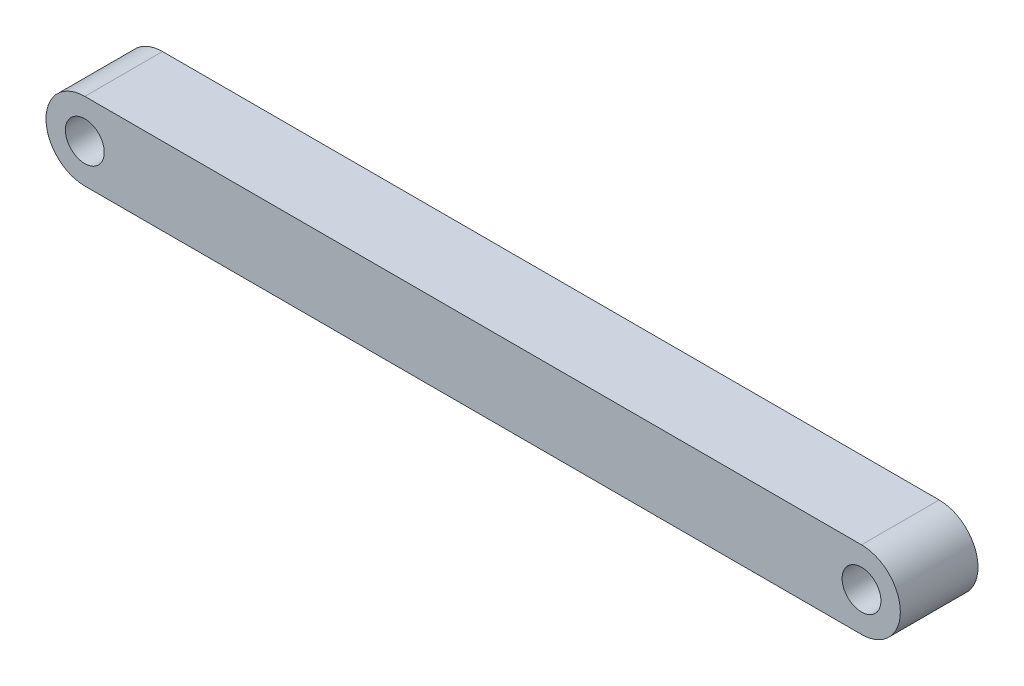
from build123d import *

# Parameters (mm, degrees)
SKETCH1_R           = 1.25
BOSS_EXTRUDE1_DEPTH = 5


with BuildPart() as part:
    # Sketch1 → Boss-Extrude1 (new body)
    with BuildSketch(Plane.XY):
        with BuildLine():
            Line((-25, 2.5), (25, 2.5))
            ThreePointArc((25, 2.5), (27.5, 0), (25, -2.5))
            Line((25, -2.5), (-25, -2.5))
            ThreePointArc((-25, -2.5), (-27.5, 0), (-25, 2.5))
        make_face()
        with Locations((-25, 0)):
            Circle(SKETCH1_R, mode=Mode.SUBTRACT)
        with Locations((25, 0)):
            Circle(SKETCH1_R, mode=Mode.SUBTRACT)
    extrude(amount=BOSS_EXTRUDE1_DEPTH)


solid = part.part
